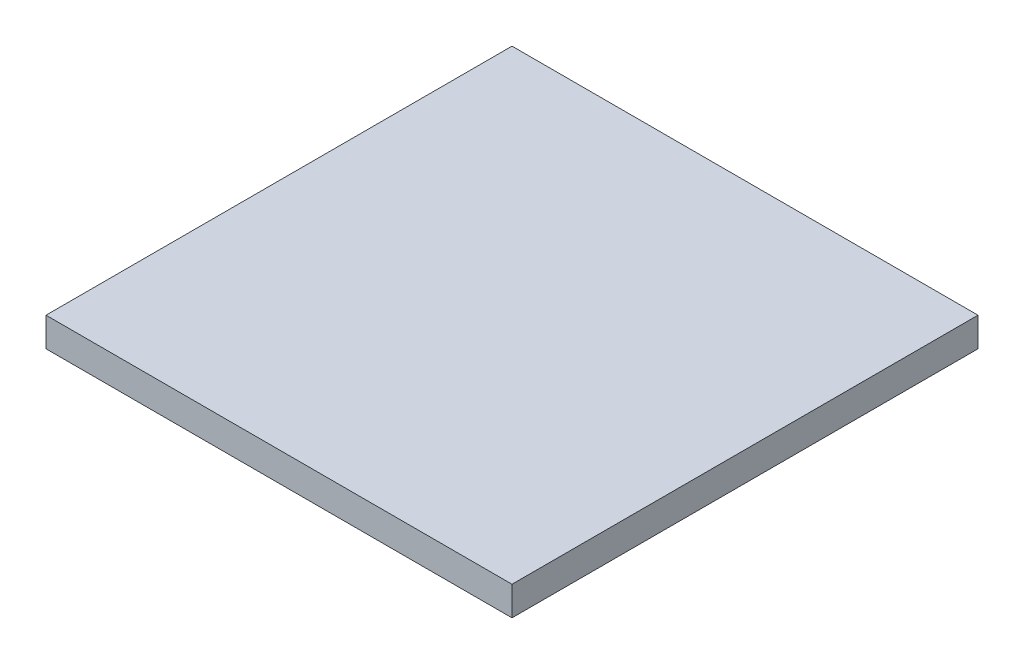
from build123d import *

# Parameters (mm, degrees)
SKETCH_1_W      = 160
SKETCH_1_H      = 160
EXTRUDE_1_DEPTH = 10


with BuildPart() as part:
    # Эскиз1 → Бобышка-Вытянуть1 (new body)
    with BuildSketch(Plane(origin=(0, 0, 0), x_dir=(1, 0, 0), z_dir=(0, 1, 0))):
        Rectangle(SKETCH_1_W, SKETCH_1_H)
    extrude(amount=-EXTRUDE_1_DEPTH)


solid = part.part
